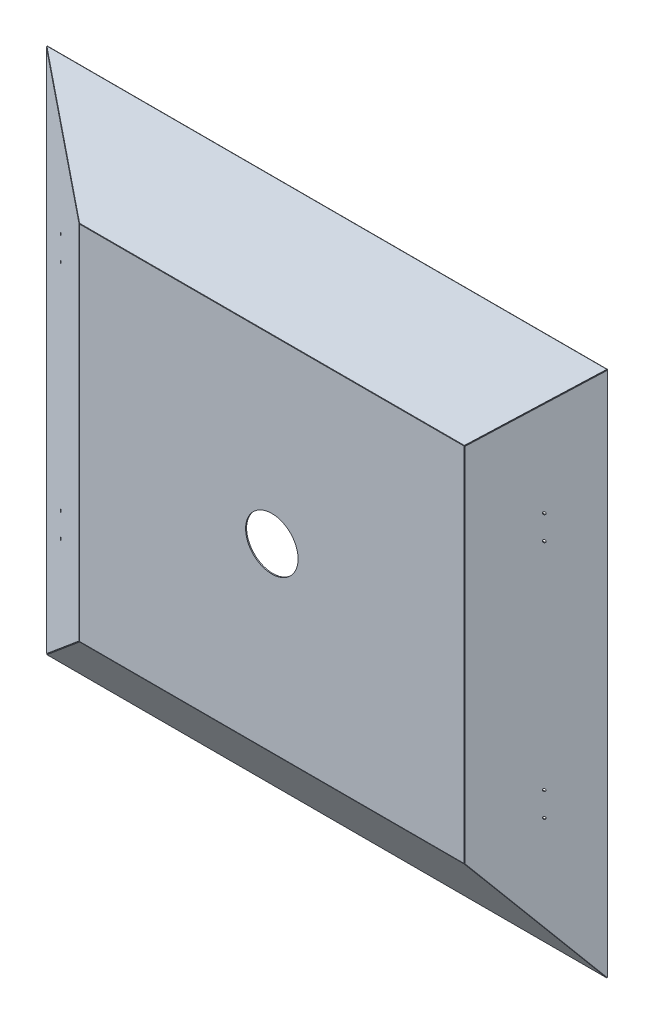
from build123d import *

# Parameters (mm, degrees)
BOSS_EXTRUDE1_DEPTH = 3
BOSS_EXTRUDE2_DEPTH = 3
BOSS_EXTRUDE3_DEPTH = 3
BOSS_EXTRUDE4_DEPTH = 3
SKETCH7_W           = 1128.588235294
SKETCH7_H           = 1060
BOSS_EXTRUDE5_DEPTH = 3
SKETCH9_R           = 4
CUT_EXTRUDE2_DEPTH  = 1343.006459444
SKETCH10_R          = 4
CUT_EXTRUDE3_DEPTH  = 1343.006459444
SKETCH11_R          = 77
CUT_EXTRUDE4_DEPTH  = 1141.74807468


with BuildPart() as part:
    # Sketch3 → Boss-Extrude1 (new body)
    with BuildSketch(Plane(origin=(0, -209.230769231, 313.846153846), x_dir=(1, 0, 0), z_dir=(0, -0.554700196225229, 0.8320502943378437))):
        Polygon((-564.294117647, -385.516636377), (564.294117647, -385.516636377), (724, -565.79420015), (821.201882058, -675.516636377), (-821.201882058, -675.516636377), (-724, -565.79420015), align=None)
    extrude(amount=BOSS_EXTRUDE1_DEPTH)


with BuildPart() as body_2:
    # Sketch4 → Boss-Extrude2 (new body)
    with BuildSketch(Plane(origin=(-203.909377292, 0, 325.655270204), x_dir=(-0.8475595635030612, 0, -0.5307002791731887), z_dir=(0.5307002791731887, 0, -0.8475595635030612))):
        Polygon((425.202848123, -530), (425.202848123, 530), (728.317549996, 771.294585358), (728.317549996, -771.294585358), align=None)
    extrude(amount=-BOSS_EXTRUDE2_DEPTH)

    # Sketch10 → Cut-Extrude3 (cut, through all)
    with BuildSketch(Plane(origin=(-203.909377292, 0, 325.655270204), x_dir=(-0.8475595635030612, 0, -0.5307002791731887), z_dir=(0.5307002791731887, 0, -0.8475595635030612))):
        with Locations((593.997278026, -387)):
            Circle(SKETCH10_R)
        with Locations((593.997278026, -316)):
            Circle(SKETCH10_R)
        with Locations((593.997278026, 316)):
            Circle(SKETCH10_R)
        with Locations((593.997278026, 387)):
            Circle(SKETCH10_R)
    extrude(amount=-CUT_EXTRUDE3_DEPTH, mode=Mode.SUBTRACT)


with BuildPart() as body_3:
    # Sketch5 → Boss-Extrude3 (new body)
    with BuildSketch(Plane(origin=(203.909377292, 0, 325.655270204), x_dir=(0.8475595635030614, 0, -0.5307002791731884), z_dir=(0.5307002791731884, 0, 0.8475595635030614))):
        Polygon((425.202848123, -530), (425.202848123, 530), (728.317549996, 771.294585358), (728.317549996, -771.294585358), align=None)
    extrude(amount=BOSS_EXTRUDE3_DEPTH)

    # Sketch9 → Cut-Extrude2 (cut, through all)
    with BuildSketch(Plane(origin=(203.909377292, 0, 325.655270204), x_dir=(-0.8475595635030615, 0, 0.5307002791731884), z_dir=(-0.5307002791731884, 0, -0.8475595635030615))):
        with Locations((-593.997278026, 387)):
            Circle(SKETCH9_R)
        with Locations((-593.997278026, 316)):
            Circle(SKETCH9_R)
        with Locations((-593.997278026, -316)):
            Circle(SKETCH9_R)
        with Locations((-593.997278026, -387)):
            Circle(SKETCH9_R)
    extrude(amount=-CUT_EXTRUDE2_DEPTH, mode=Mode.SUBTRACT)


with BuildPart() as body_4:
    # Sketch6 → Boss-Extrude4 (new body)
    with BuildSketch(Plane(origin=(0, 209.230769231, 313.846153846), x_dir=(-1, 0, 0), z_dir=(0, -0.554700196225229, -0.8320502943378437))):
        Polygon((-564.294117647, 385.516636377), (564.294117647, 385.516636377), (821.201882058, 675.516636377), (-821.201882058, 675.516636377), align=None)
    extrude(amount=-BOSS_EXTRUDE4_DEPTH)


with BuildPart() as body_5:
    # Sketch7 → Boss-Extrude5 (new body)
    with BuildSketch(Plane.XY.offset(100)):
        Rectangle(SKETCH7_W, SKETCH7_H)
    extrude(amount=BOSS_EXTRUDE5_DEPTH)

    # Sketch11 → Cut-Extrude4 (cut, through all)
    with BuildSketch(Plane.XY.offset(103)):
        Circle(SKETCH11_R)
    extrude(amount=-CUT_EXTRUDE4_DEPTH, mode=Mode.SUBTRACT)


solid = Compound([part.part, body_2.part, body_3.part, body_4.part, body_5.part])
